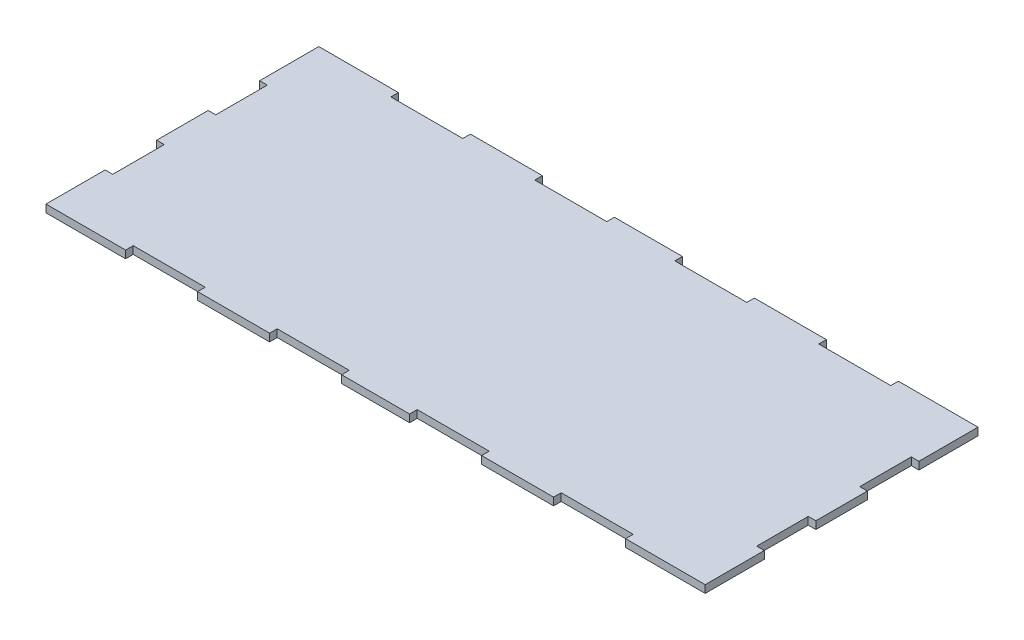
from build123d import *

# Parameters (mm, degrees)
SALIENTE_EXTRUIR1_DEPTH = 3


with BuildPart() as part:
    # Croquis1 → Saliente-Extruir1 (new body)
    with BuildSketch(Plane(origin=(0, 0, 0), x_dir=(1, 0, 0), z_dir=(0, 1, 0))):
        Polygon((3, 107.6), (31.4, 107.6), (31.4, 104.6), (59.8, 104.6), (59.8, 107.6), (88.2, 107.6), (88.2, 104.6), (116.6, 104.6), (116.6, 107.6), (143.4, 107.6), (143.4, 104.6), (171.8, 104.6), (171.8, 107.6), (200.2, 107.6), (200.2, 104.6), (228.6, 104.6), (228.6, 107.6), (257, 107.6), (260, 107.6), (260, 104.6), (260, 84.28), (257, 84.28), (257, 63.96), (260, 63.96), (260, 43.64), (257, 43.64), (257, 23.32), (260, 23.32), (260, 3), (260, 0), (257, 0), (228.6, 0), (228.6, 3), (200.2, 3), (200.2, 0), (171.8, 0), (171.8, 3), (143.4, 3), (143.4, 0), (116.6, 0), (116.6, 3), (88.2, 3), (88.2, 0), (59.8, 0), (59.8, 3), (31.4, 3), (31.4, 0), (3, 0), (0, 0), (0, 3), (0, 23.32), (3, 23.32), (3, 43.64), (0, 43.64), (0, 63.96), (3, 63.96), (3, 84.28), (0, 84.28), (0, 104.6), (0, 107.6), align=None)
    extrude(amount=SALIENTE_EXTRUIR1_DEPTH)


solid = part.part
